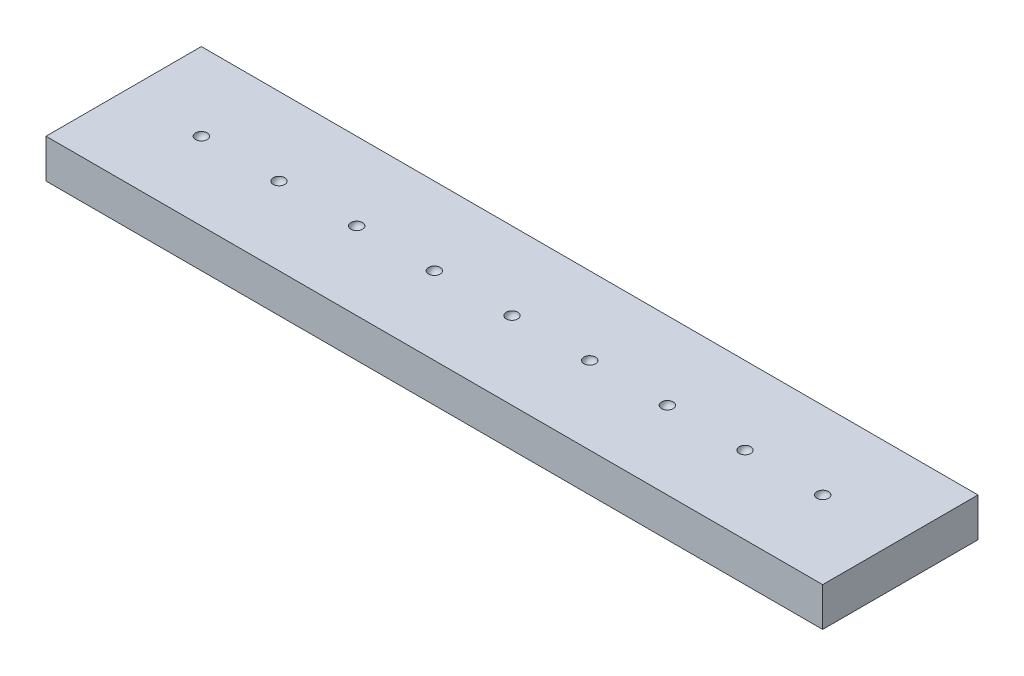
from build123d import *

# Parameters (mm, degrees)
SKETCH_1_W      = 100
SKETCH_1_H      = 20
EXTRUDE_1_DEPTH = 5


with BuildPart() as part:
    # 草图1 → 凸台-拉伸1 (new body)
    with BuildSketch(Plane(origin=(0, 0, 0), x_dir=(1, 0, 0), z_dir=(0, 1, 0))):
        with Locations((50, 10)):
            Rectangle(SKETCH_1_W, SKETCH_1_H)
    extrude(amount=EXTRUDE_1_DEPTH)

    # 草图2 → 切除-旋转3 (revolve, cut)
    with BuildSketch(Plane(origin=(0, 5, 0), x_dir=(1, 0, 0), z_dir=(0, 1, 0))):
        with BuildLine():
            Line((10.75, 10), (9.25, 10))
            ThreePointArc((9.25, 10), (10, 9.25), (10.75, 10))
        make_face()
        with BuildLine():
            Line((20.75, 10), (19.25, 10))
            ThreePointArc((19.25, 10), (20, 9.25), (20.75, 10))
        make_face()
        with BuildLine():
            Line((30.75, 10), (29.25, 10))
            ThreePointArc((29.25, 10), (30, 9.25), (30.75, 10))
        make_face()
        with BuildLine():
            Line((40.75, 10), (39.25, 10))
            ThreePointArc((39.25, 10), (40, 9.25), (40.75, 10))
        make_face()
        with BuildLine():
            Line((50.75, 10), (49.25, 10))
            ThreePointArc((49.25, 10), (50, 9.25), (50.75, 10))
        make_face()
        with BuildLine():
            Line((60.75, 10), (59.25, 10))
            ThreePointArc((59.25, 10), (60, 9.25), (60.75, 10))
        make_face()
        with BuildLine():
            Line((70.75, 10), (69.25, 10))
            ThreePointArc((69.25, 10), (70, 9.25), (70.75, 10))
        make_face()
        with BuildLine():
            Line((80.75, 10), (79.25, 10))
            ThreePointArc((79.25, 10), (80, 9.25), (80.75, 10))
        make_face()
        with BuildLine():
            Line((90.75, 10), (89.25, 10))
            ThreePointArc((89.25, 10), (90, 9.25), (90.75, 10))
        make_face()
    revolve(axis=Axis((0, 5, -10), (1, 0, 0)), mode=Mode.SUBTRACT)


solid = part.part
